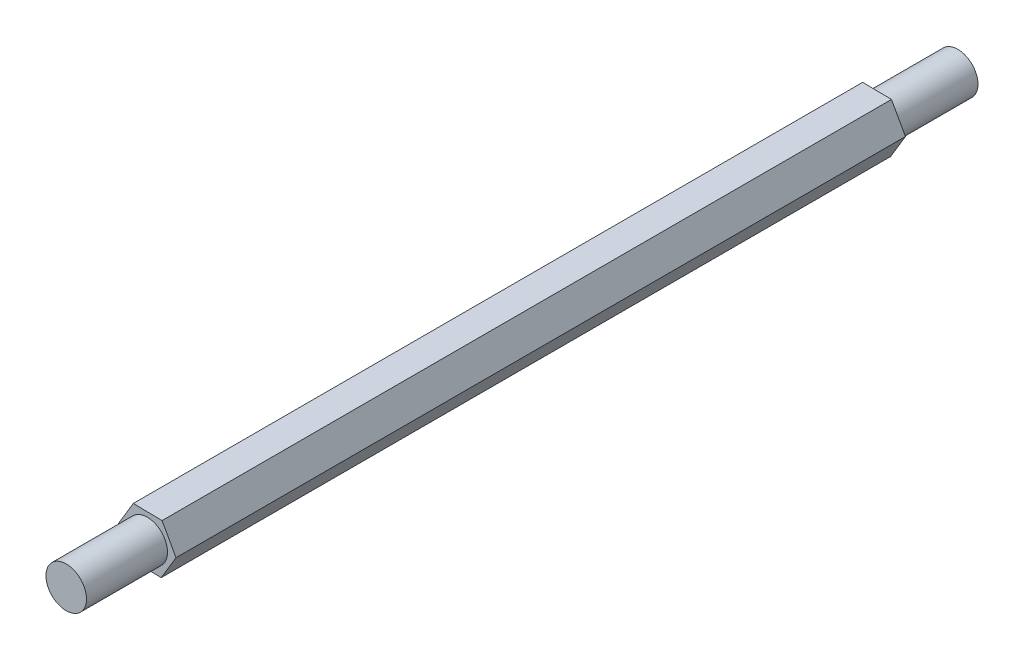
from build123d import *

# Parameters (mm, degrees)
SKETCH_1_R      = 2.5
EXTRUDE_1_DEPTH = 10
EXTRUDE_2_DEPTH = 90
SKETCH_3_R      = 2.5
EXTRUDE_3_DEPTH = 10


with BuildPart() as part:
    # 草图1 → 凸台-拉伸1 (new body)
    with BuildSketch(Plane.XY):
        Circle(SKETCH_1_R)
    extrude(amount=EXTRUDE_1_DEPTH)

    # 草图2 → 凸台-拉伸2 (add)
    with BuildSketch(Plane.XY.offset(10)):
        Polygon((3.549191068, -0.056914546), (1.823884976, 3.045232355), (-1.725306092, 3.1021469), (-3.549191068, 0.056914546), (-1.823884976, -3.045232355), (1.725306092, -3.1021469), align=None)
    extrude(amount=EXTRUDE_2_DEPTH)

    # 草图3 → 凸台-拉伸3 (add)
    with BuildSketch(Plane.XY.offset(100)):
        Circle(SKETCH_3_R)
    extrude(amount=EXTRUDE_3_DEPTH)


solid = part.part
